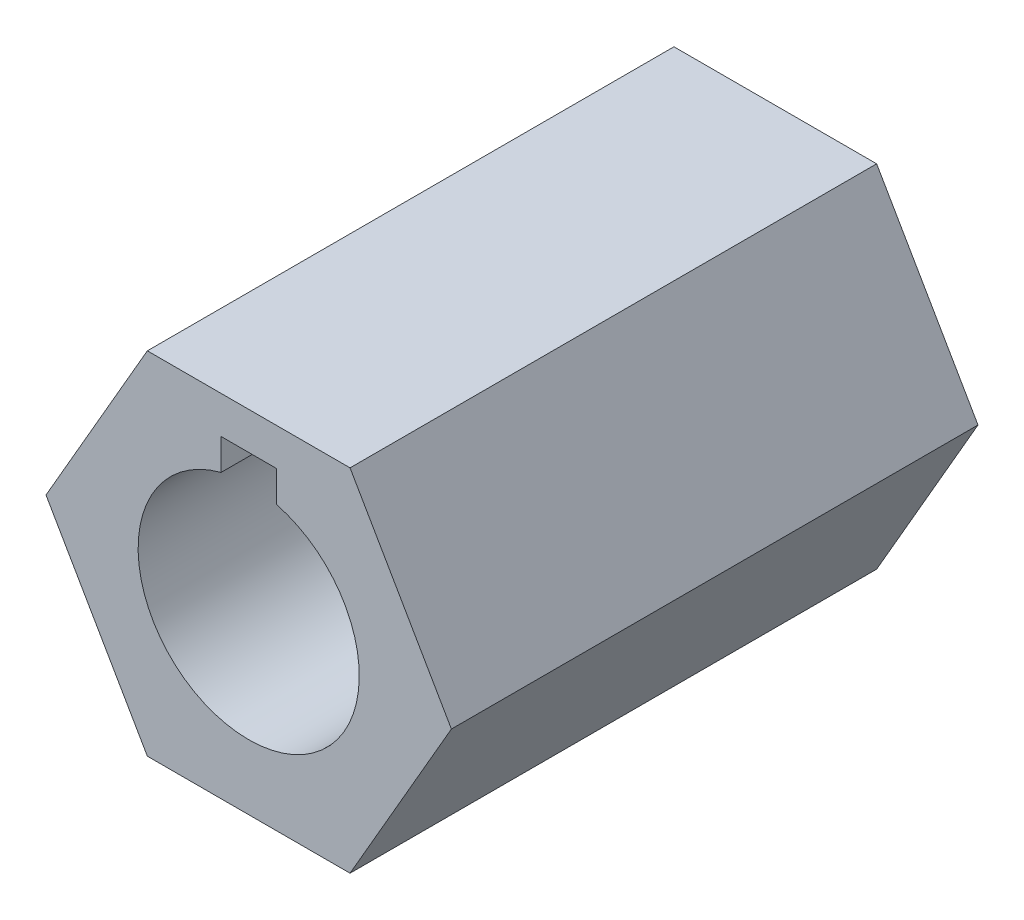
from build123d import *

# Parameters (mm, degrees)
BOSS_EXTRUDE1_DEPTH = 19.05


with BuildPart() as part:
    # Sketch1 → Boss-Extrude1 (new body)
    with BuildSketch(Plane.XY):
        Polygon((3.666174209, -6.35), (7.332348419, 0), (3.666174209, 6.35), (-3.666174209, 6.35), (-7.332348419, 0), (-3.666174209, -6.35), align=None)
        with BuildLine():
            Line((1, 5), (1, 3.872983346))
            ThreePointArc((1, 3.872983346), (3.16227766, 2.449489743), (4, 0))
            ThreePointArc((4, 0), (-2.449489743, -3.16227766), (-1, 3.872983346))
            Line((-1, 3.872983346), (-1, 5))
            Line((-1, 5), (1, 5))
        make_face(mode=Mode.SUBTRACT)
    extrude(amount=BOSS_EXTRUDE1_DEPTH)


solid = part.part
